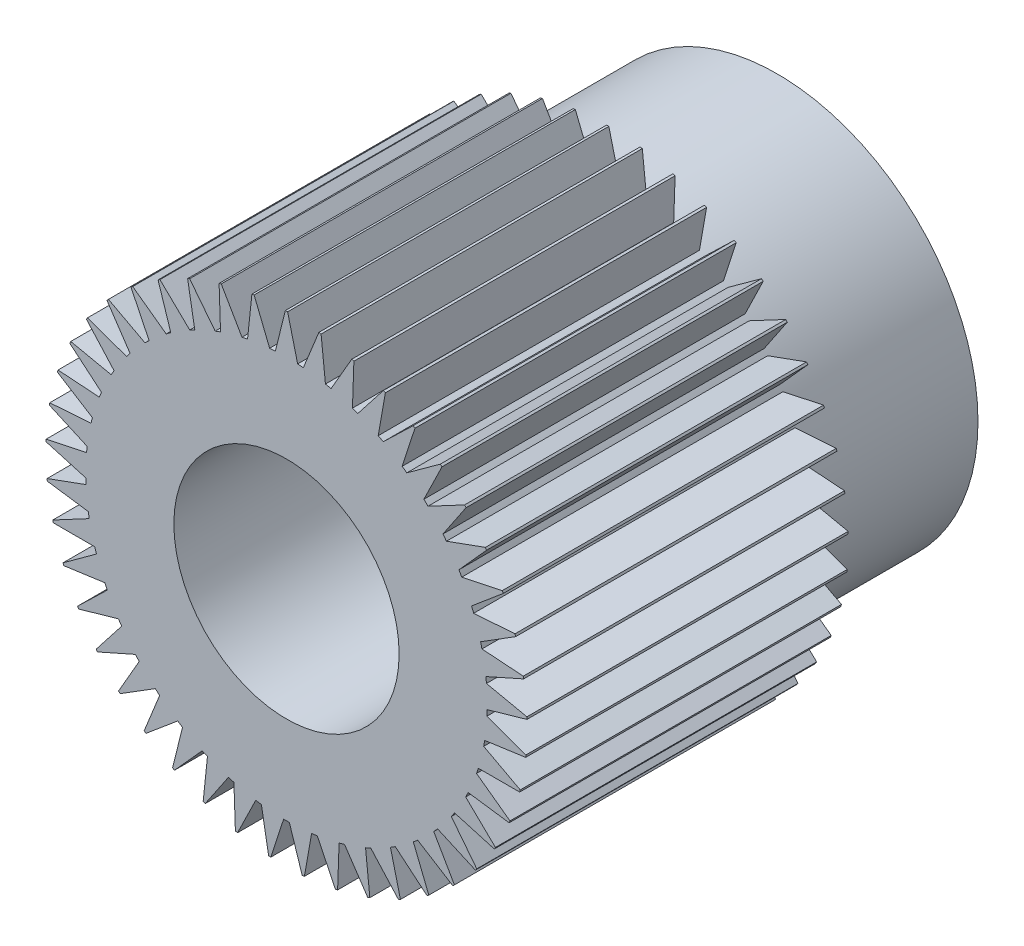
from build123d import *

# Parameters (mm, degrees)
SKETCH1_R           = 4.5
BOSS_EXTRUDE1_DEPTH = 11
SKETCH2_R           = 2.525
CUT_EXTRUDE1_DEPTH  = 13.708265027
BOSS_EXTRUDE2_START = -7.2
BOSS_EXTRUDE2_DEPTH = 7.2
CIRPATTERN2_COUNT   = 45


with BuildPart() as part:
    # Sketch1 → Boss-Extrude1 (new body)
    with BuildSketch(Plane.XY):
        Circle(SKETCH1_R)
    extrude(amount=BOSS_EXTRUDE1_DEPTH)

    # Sketch2 → Cut-Extrude1 (cut, through all)
    with BuildSketch(Plane.XY.offset(11)):
        Circle(SKETCH2_R)
    extrude(amount=-CUT_EXTRUDE1_DEPTH, mode=Mode.SUBTRACT)

    # Sketch3 → Boss-Extrude2 (add)
    with BuildSketch(Plane.XY.offset(11).offset(BOSS_EXTRUDE2_START)):
        with BuildLine():
            Line((-0.25, 4.493050189), (-0.025, 5.393050189))
            Line((-0.025, 5.393050189), (0.025, 5.393050189))
            Line((0.025, 5.393050189), (0.25, 4.493050189))
            ThreePointArc((0.25, 4.493050189), (0, 4.5), (-0.25, 4.493050189))
        make_face()
    boss_extrude2 = extrude(amount=BOSS_EXTRUDE2_DEPTH)

    # CirPattern2: Boss-Extrude2 ×45 about axis
    cirpattern2_axis = Axis((0, 0, 0), (0, 0, 1))
    for i in range(1, CIRPATTERN2_COUNT):
        add(boss_extrude2.rotate(cirpattern2_axis, i * 360 / CIRPATTERN2_COUNT))


solid = part.part
